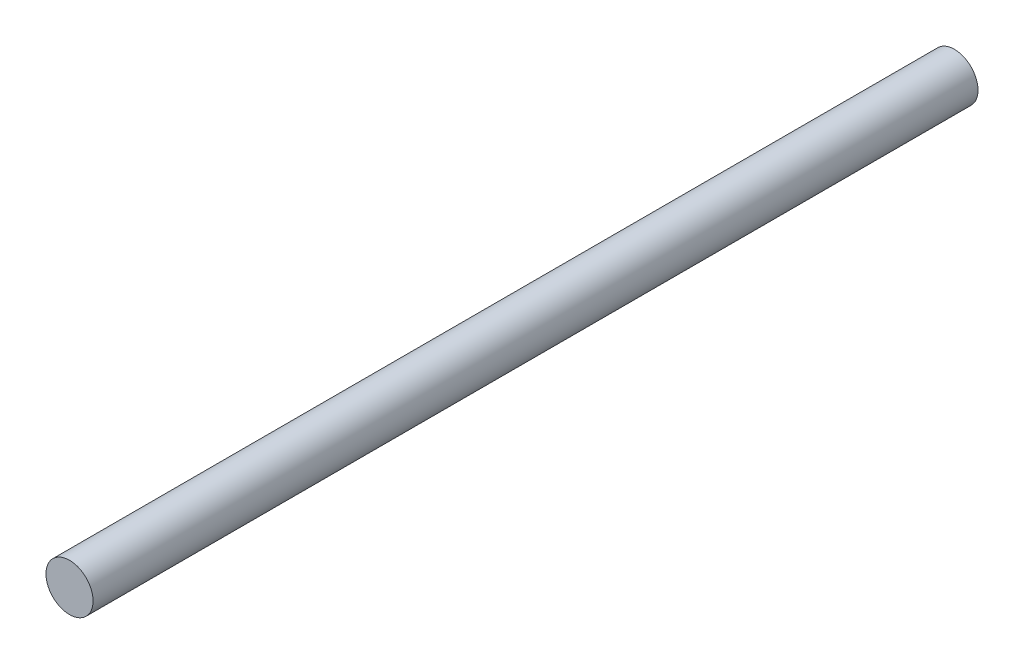
from build123d import *

# Parameters (mm, degrees)
SKETCH1_R           = 3.9
BOSS_EXTRUDE1_DEPTH = 146.5


with BuildPart() as part:
    # Sketch1 → Boss-Extrude1 (new body)
    with BuildSketch(Plane.XY):
        Circle(SKETCH1_R)
    extrude(amount=BOSS_EXTRUDE1_DEPTH)


solid = part.part
